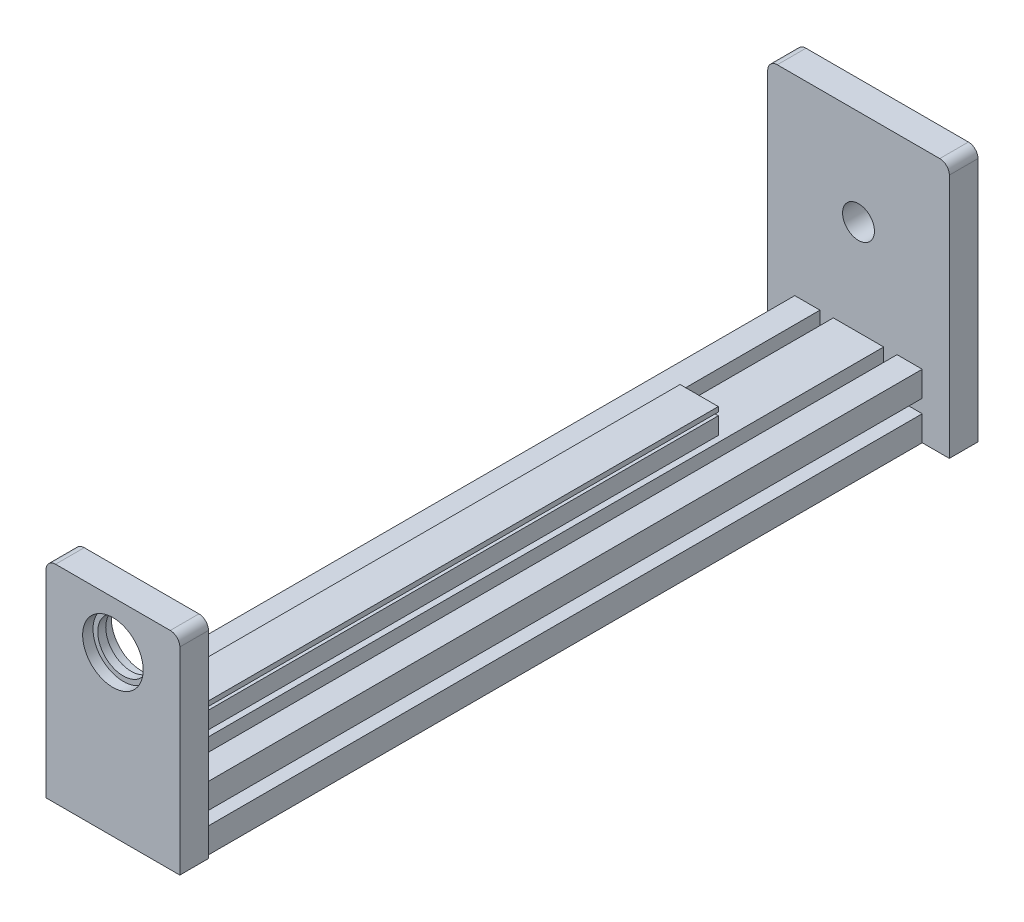
from build123d import *

# Parameters (mm, degrees)
EXTRUDE_1_DEPTH     = 9
EXTRUDE_2_DEPTH     = 225
EXTRUDE_3_DEPTH     = 9
SKETCH_6_R          = 9.5
CUT_EXTRUDE_3_DEPTH = 3.25
CUT_EXTRUDE_START   = -3.25
SKETCH_7_R          = 9.5
CUT_EXTRUDE_4_DEPTH = 3.25
EXTRUDE_4_DEPTH     = 175
CUT_EXTRUDE_5_REACH = 246.729
SKETCH_10_R         = 8
SKETCH_11_R         = 5
CUT_EXTRUDE_6_DEPTH = 10


with BuildPart() as part:
    # 草图1 → 凸台-拉伸1 (new body)
    with BuildSketch(Plane.XY):
        with BuildLine():
            Line((-25.5, 40), (25.5, 40))
            ThreePointArc((25.5, 40), (27.621320344, 39.121320344), (28.5, 37))
            Line((28.5, 37), (28.5, -40))
            Line((28.5, -40), (-28.5, -40))
            Line((-28.5, -40), (-28.5, 37))
            ThreePointArc((-28.5, 37), (-27.621320344, 39.121320344), (-25.5, 40))
        make_face()
    extrude(amount=EXTRUDE_1_DEPTH)

    # 草图2 → 凸台-拉伸2 (add)
    with BuildSketch(Plane.XY.offset(9)):
        Polygon((-20, -40), (-12.1, -40), (-12.1, -33.8), (-7.9, -33.8), (-7.9, -40), (7.9, -40), (7.9, -33.8), (12.1, -33.8), (12.1, -40), (20, -40), (20, -32.1), (13.8, -32.1), (13.8, -27.9), (20, -27.9), (20, -20), (12.1, -20), (12.1, -26.2), (7.9, -26.2), (7.9, -20), (-7.9, -20), (-7.9, -26.2), (-12.1, -26.2), (-12.1, -20), (-20, -20), (-20, -27.9), (-13.8, -27.9), (-13.8, -32.1), (-20, -32.1), align=None)
    extrude(amount=EXTRUDE_2_DEPTH)

    # 草图3 → 凸台-拉伸3 (add)
    with BuildSketch(Plane.XY.offset(234)):
        with BuildLine():
            Line((-21, -40), (21, -40))
            Line((21, -40), (21, 22))
            ThreePointArc((21, 22), (20.121320344, 24.121320344), (18, 25))
            Line((18, 25), (-18, 25))
            ThreePointArc((-18, 25), (-20.121320344, 24.121320344), (-21, 22))
            Line((-21, 22), (-21, -40))
        make_face()
    extrude(amount=EXTRUDE_3_DEPTH)

    # 草图6 → 切除-拉伸3 (cut)
    with BuildSketch(Plane.XY.offset(243)):
        with Locations((0, 10)):
            Circle(SKETCH_6_R)
    extrude(amount=-CUT_EXTRUDE_3_DEPTH, mode=Mode.SUBTRACT)

    # 草图7 → 切除-拉伸4 (cut)
    with BuildSketch(Plane(origin=(0, 0, 234), x_dir=(-1, 0, 0), z_dir=(0, 0, -1)).offset(CUT_EXTRUDE_START)):
        with Locations(Location((0, 10, 0), (0, 0, 180))):
            Circle(SKETCH_7_R)
    extrude(amount=CUT_EXTRUDE_4_DEPTH, mode=Mode.SUBTRACT)

    # 草图8 → 凸台-拉伸4 (add)
    with BuildSketch(Plane(origin=(0, 0, 234), x_dir=(-1, 0, 0), z_dir=(0, 0, -1))):
        Polygon((-6, -20), (6, -20), (6, -14.65), (4.5, -14.65), (4.5, -13.65), (6, -13.65), (6, -12.15), (-6, -12.15), (-6, -13.65), (-4.5, -13.65), (-4.5, -14.65), (-6, -14.65), align=None)
    extrude(amount=EXTRUDE_4_DEPTH)

    # 草图10 → 切除-拉伸5 (cut, up to next)
    with BuildSketch(Plane.XY.offset(239.75), mode=Mode.PRIVATE) as cut_extrude_5_sk1:
        with Locations((0, 10)):
            Circle(SKETCH_10_R)
    cut_extrude_5_tool1 = extrude(cut_extrude_5_sk1.sketch, amount=-CUT_EXTRUDE_5_REACH, mode=Mode.PRIVATE) & part.part
    add(cut_extrude_5_tool1.solids().sort_by_distance((0, 10, 239.75))[0], mode=Mode.SUBTRACT)

    # 草图11 → 切除-拉伸6 (cut)
    with BuildSketch(Plane(origin=(0, 0, 0), x_dir=(-1, 0, 0), z_dir=(0, 0, -1))):
        with Locations((0, 10)):
            Circle(SKETCH_11_R)
    extrude(amount=-CUT_EXTRUDE_6_DEPTH, mode=Mode.SUBTRACT)


solid = part.part
